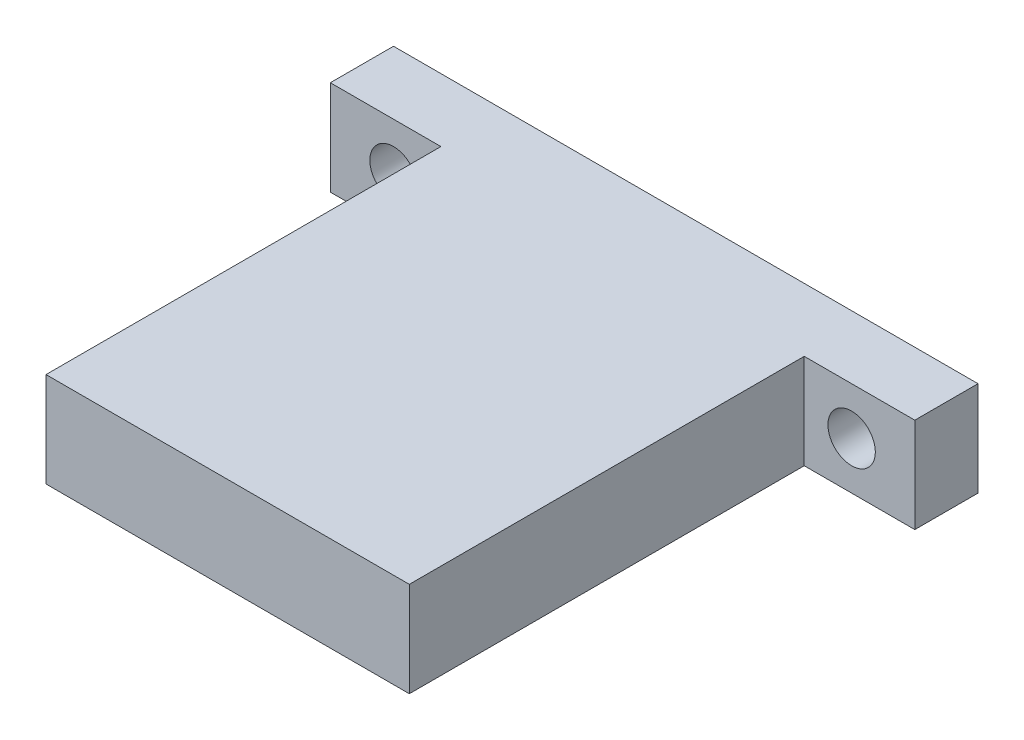
from build123d import *

# Parameters (mm, degrees)
CROQUIS1_W              = 37
CROQUIS1_H              = 10
SALIENTE_EXTRUIR1_DEPTH = 25
CROQUIS2_W              = 37
CROQUIS2_H              = 6
CORTAR_EXTRUIR1_DEPTH   = 21
CROQUIS4_R              = 1.5
CORTAR_EXTRUIR2_DEPTH   = 4
CROQUIS6_W              = 37
CROQUIS6_H              = 4
CORTAR_EXTRUIR3_DEPTH   = 4
CROQUIS8_W              = 23
CROQUIS8_H              = 6
SALIENTE_EXTRUIR2_DEPTH = 25


with BuildPart() as part:
    # Croquis1 → Saliente-Extruir1 (new body)
    with BuildSketch(Plane.XY):
        with Locations((-18.845794393, 11.401869159)):
            Rectangle(CROQUIS1_W, CROQUIS1_H)
    extrude(amount=SALIENTE_EXTRUIR1_DEPTH)

    # Croquis2 → Cortar-Extruir1 (cut)
    with BuildSketch(Plane.XY.offset(25)):
        with Locations((-18.845794393, 9.401869159)):
            Rectangle(CROQUIS2_W, CROQUIS2_H)
    extrude(amount=-CORTAR_EXTRUIR1_DEPTH, mode=Mode.SUBTRACT)

    # Croquis4 → Cortar-Extruir2 (cut)
    with BuildSketch(Plane.XY.offset(4)):
        with Locations((-33.345794393, 9.401869159)):
            Circle(CROQUIS4_R)
        with Locations((-4.345794393, 9.401869159)):
            Circle(CROQUIS4_R)
    extrude(amount=-CORTAR_EXTRUIR2_DEPTH, mode=Mode.SUBTRACT)

    # Croquis6 → Cortar-Extruir3 (cut)
    with BuildSketch(Plane(origin=(0, 0, 0), x_dir=(-1, 0, 0), z_dir=(0, 0, -1))):
        with Locations((18.845794393, 14.401869159)):
            Rectangle(CROQUIS6_W, CROQUIS6_H)
    extrude(amount=-CORTAR_EXTRUIR3_DEPTH, mode=Mode.SUBTRACT)


with BuildPart() as cortar_extruir3_kept_piece:
    # of the separate pieces the step leaves, the one the design keeps (cortar_extruir3_pieces_kept)
    add(part.part.solids().sort_by_distance((-37.345794393, 6.401869159, 0))[0])

    # Croquis8 → Saliente-Extruir2 (add)
    with BuildSketch(Plane.XY.offset(4)):
        with Locations((-18.845794393, 9.401869159)):
            Rectangle(CROQUIS8_W, CROQUIS8_H)
    extrude(amount=SALIENTE_EXTRUIR2_DEPTH)


solid = cortar_extruir3_kept_piece.part
